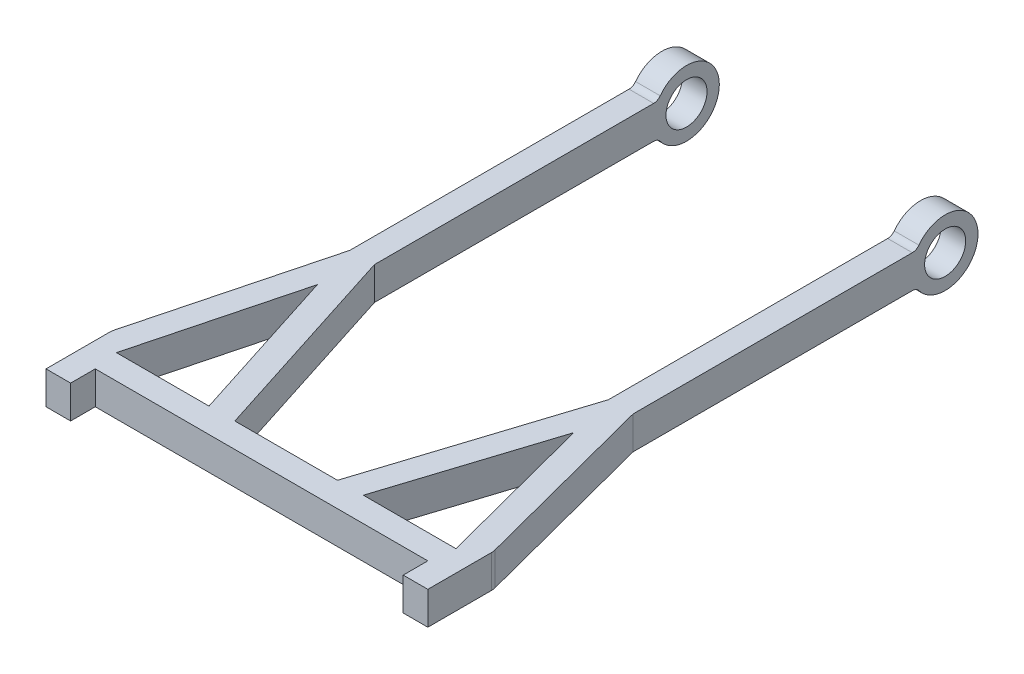
from build123d import *

# Parameters (mm, degrees)
BOSS_EXTRUDE1_DEPTH     = 1
BOSS_EXTRUDE2_START     = 7.125
BOSS_EXTRUDE2_DEPTH     = 1.5
BOSS_EXTRUDE3_START     = -8.625
BOSS_EXTRUDE3_DEPTH     = 1.5
CUT_EXTRUDE1_DEPTH      = 37.224344369
CUT_EXTRUDE1_DEPTH_BACK = 37.224344369
SKETCH3_R               = 1.25


with BuildPart() as part:
    # Sketch1 → Boss-Extrude1 (new, symmetric)
    with BuildSketch(Plane(origin=(0, 0, 0), x_dir=(1, 0, 0), z_dir=(0, 1, 0))):
        with BuildLine():
            Line((-10.125, -0.75), (0, -0.75))
            Line((0, -0.75), (0, 0.75))
            Line((0, 0.75), (-3.125, 0.75))
            Line((-3.125, 0.75), (-7.125, 13.25))
            Line((-7.125, 13.25), (-7.125, 30.25))
            Line((-7.125, 30.25), (-8.625, 30.25))
            Line((-8.625, 30.25), (-8.625, 13.25))
            Line((-8.625, 13.25), (-11.592617272, 1.874133789))
            ThreePointArc((-11.592617272, 1.874133789), (-11.61687128, 1.748957182), (-11.625, 1.621711892))
            Line((-11.625, 1.621711892), (-11.625, -0.75))
            Line((-11.625, -0.75), (-11.625, -2.25))
            Line((-11.625, -2.25), (-10.125, -2.25))
            Line((-10.125, -2.25), (-10.125, -0.75))
        make_face()
        Polygon((-4.69992857, 0.75), (-7.804648328, 10.452249246), (-10.335669871, 0.75), align=None, mode=Mode.SUBTRACT)
    boss_extrude1 = extrude(amount=BOSS_EXTRUDE1_DEPTH, both=True)

    # Mirror1: Boss-Extrude1 across plane
    add(boss_extrude1.mirror(Plane(origin=(0, 0, 0), x_dir=(0, 0, 1), z_dir=(1, 0, 0))))

    # Sketch2 → Boss-Extrude2 (add)
    with BuildSketch(Plane(origin=(0, 0, 0), x_dir=(0, 0, -1), z_dir=(1, 0, 0)).offset(BOSS_EXTRUDE2_START)):
        with BuildLine():
            Line((30.25, 1), (30.25, -1))
            ThreePointArc((30.25, -1), (30.473606798, -1.052786405), (30.65, -1.2))
            ThreePointArc((30.65, -1.2), (34.25, 0), (30.65, 1.2))
            ThreePointArc((30.65, 1.2), (30.473606798, 1.052786405), (30.25, 1))
        make_face()
    extrude(amount=BOSS_EXTRUDE2_DEPTH)

    # Sketch2<2> → Boss-Extrude3 (add)
    with BuildSketch(Plane(origin=(0, 0, 0), x_dir=(0, 0, -1), z_dir=(1, 0, 0)).offset(BOSS_EXTRUDE3_START)):
        with BuildLine():
            Line((30.25, 1), (30.25, -1))
            ThreePointArc((30.25, -1), (30.473606798, -1.052786405), (30.65, -1.2))
            ThreePointArc((30.65, -1.2), (34.25, 0), (30.65, 1.2))
            ThreePointArc((30.65, 1.2), (30.473606798, 1.052786405), (30.25, 1))
        make_face()
    extrude(amount=BOSS_EXTRUDE3_DEPTH)

    # Sketch3 → Cut-Extrude1 (cut, two sides: drawn at the far end of the back side and taken through both)
    with BuildSketch(Plane(origin=(0, 0, 0), x_dir=(0, 0, -1), z_dir=(1, 0, 0)).offset(-CUT_EXTRUDE1_DEPTH_BACK)):
        with Locations((32.25, 0)):
            Circle(SKETCH3_R)
    extrude(amount=CUT_EXTRUDE1_DEPTH + CUT_EXTRUDE1_DEPTH_BACK, mode=Mode.SUBTRACT)


solid = part.part
